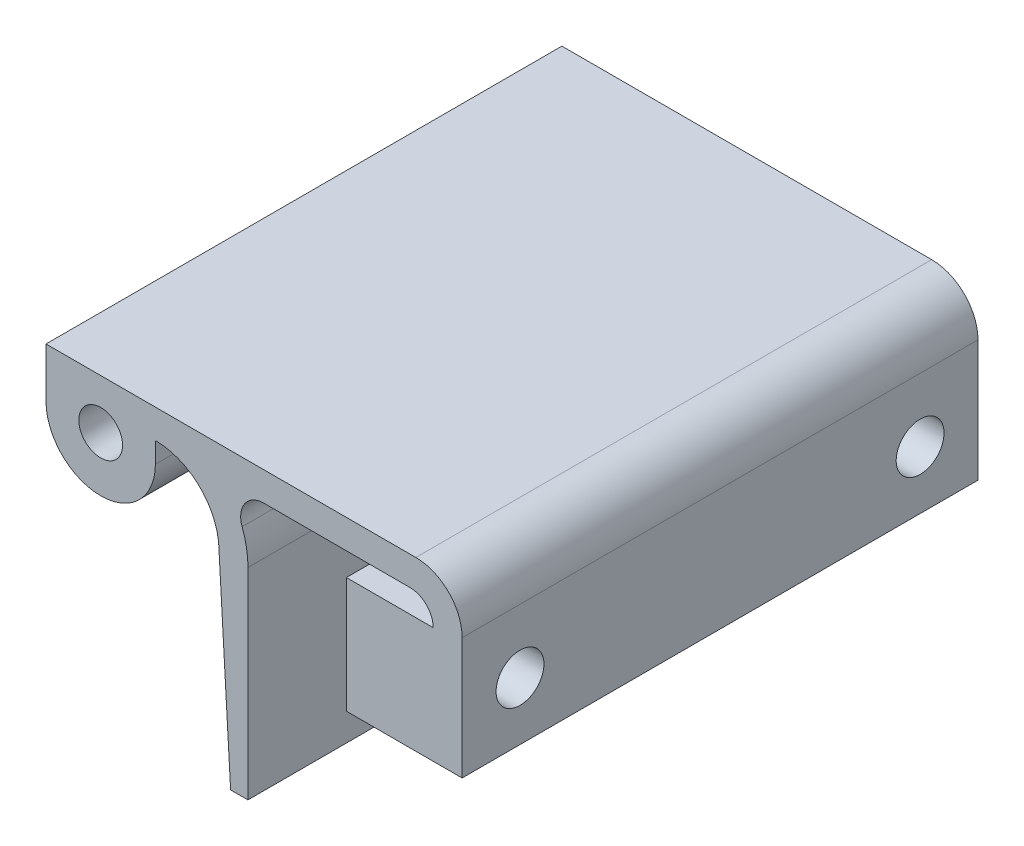
from build123d import *

# Parameters (mm, degrees)
SKETCH1_R           = 2.4
BOSS_EXTRUDE1_DEPTH = 56.59882
SKETCH7_W           = 12.7
SKETCH7_H           = 12.7
BOSS_EXTRUDE3_DEPTH = 12.7
CUT_EXTRUDE2_REACH  = 228.355
SKETCH8_R           = 2.625
FILLET1_R           = 5.08


with BuildPart() as part:
    # Sketch1 → Boss-Extrude1 (new body)
    with BuildSketch(Plane.XY):
        with BuildLine():
            Line((-77.443191063, 182.115759687), (-79.348229949, 182.102566798))
            Line((-79.348229949, 182.102566798), (-80.618191063, 204.196458108))
            ThreePointArc((-80.618191063, 204.196458108), (-82.664050197, 209.135598974), (-87.603191063, 211.181458108))
            Line((-87.603191063, 211.181458108), (-87.603191063, 208.926458108))
            ThreePointArc((-87.603191063, 208.926458108), (-93.603191063, 202.926458108), (-99.603191063, 208.926458108))
            Line((-99.603191063, 208.926458108), (-99.603191063, 214.356458108))
            Line((-99.603191063, 214.356458108), (-90.238191127, 214.356458108))
            Line((-90.238191127, 214.356458108), (-87.603191063, 214.356458108))
            Line((-87.603191063, 214.356458108), (-76.173191063, 214.356458108))
            Line((-76.173191063, 214.356458108), (-53.948191063, 214.356458108))
            Line((-53.948191063, 214.356458108), (-53.948191063, 195.941458108))
            Line((-53.948191063, 195.941458108), (-57.123191063, 195.941458108))
            Line((-57.123191063, 195.941458108), (-57.123191063, 208.641458108))
            ThreePointArc((-57.123191063, 208.641458108), (-57.867139839, 210.437509332), (-59.663191063, 211.181458108))
            Line((-59.663191063, 211.181458108), (-75.706469876, 211.181458108))
            ThreePointArc((-75.706469876, 211.181458108), (-77.79329282, 210.089480898), (-78.085814114, 207.752458108))
            ThreePointArc((-78.085814114, 207.752458108), (-77.605137508, 206.003257791), (-77.443191063, 204.196458108))
            Line((-77.443191063, 204.196458108), (-77.443191063, 182.115759687))
        make_face()
        with Locations((-93.603191063, 208.926458108)):
            Circle(SKETCH1_R, mode=Mode.SUBTRACT)
    extrude(amount=BOSS_EXTRUDE1_DEPTH)

    # Sketch7 → Boss-Extrude3 (add)
    with BuildSketch(Plane(origin=(-53.948191063, 0, 0), x_dir=(0, 0, -1), z_dir=(1, 0, 0))):
        with Locations((-50.24882, 202.291458108)):
            Rectangle(SKETCH7_W, SKETCH7_H)
        with Locations((-6.35, 202.291458108)):
            Rectangle(SKETCH7_W, SKETCH7_H)
    extrude(amount=-BOSS_EXTRUDE3_DEPTH)

    # Sketch8 → Cut-Extrude2 (cut, up to next)
    with BuildSketch(Plane(origin=(-53.948191063, 0, 0), x_dir=(0, 0, -1), z_dir=(1, 0, 0)), mode=Mode.PRIVATE) as cut_extrude2_sk1:
        with Locations((-50.24882, 202.291458108)):
            Circle(SKETCH8_R)
    cut_extrude2_tool1 = extrude(cut_extrude2_sk1.sketch, amount=-CUT_EXTRUDE2_REACH, mode=Mode.PRIVATE) & part.part
    # Sketch8 → Cut-Extrude2 (cut, up to next)
    with BuildSketch(Plane(origin=(-53.948191063, 0, 0), x_dir=(0, 0, -1), z_dir=(1, 0, 0)), mode=Mode.PRIVATE) as cut_extrude2_sk2:
        with Locations((-6.35, 202.291458108)):
            Circle(SKETCH8_R)
    cut_extrude2_tool2 = extrude(cut_extrude2_sk2.sketch, amount=-CUT_EXTRUDE2_REACH, mode=Mode.PRIVATE) & part.part
    add(cut_extrude2_tool1.solids().sort_by_distance((-53.948191, 202.291458, 50.24882))[0], mode=Mode.SUBTRACT)
    add(cut_extrude2_tool2.solids().sort_by_distance((-53.948191, 202.291458, 6.35))[0], mode=Mode.SUBTRACT)

    # Fillet1
    fillet1_edges = [part.edges().sort_by_distance(p)[0] for p in [
        (-53.948191063, 214.356458108, 28.29941),
    ]]
    fillet(fillet1_edges, radius=FILLET1_R)


solid = part.part
